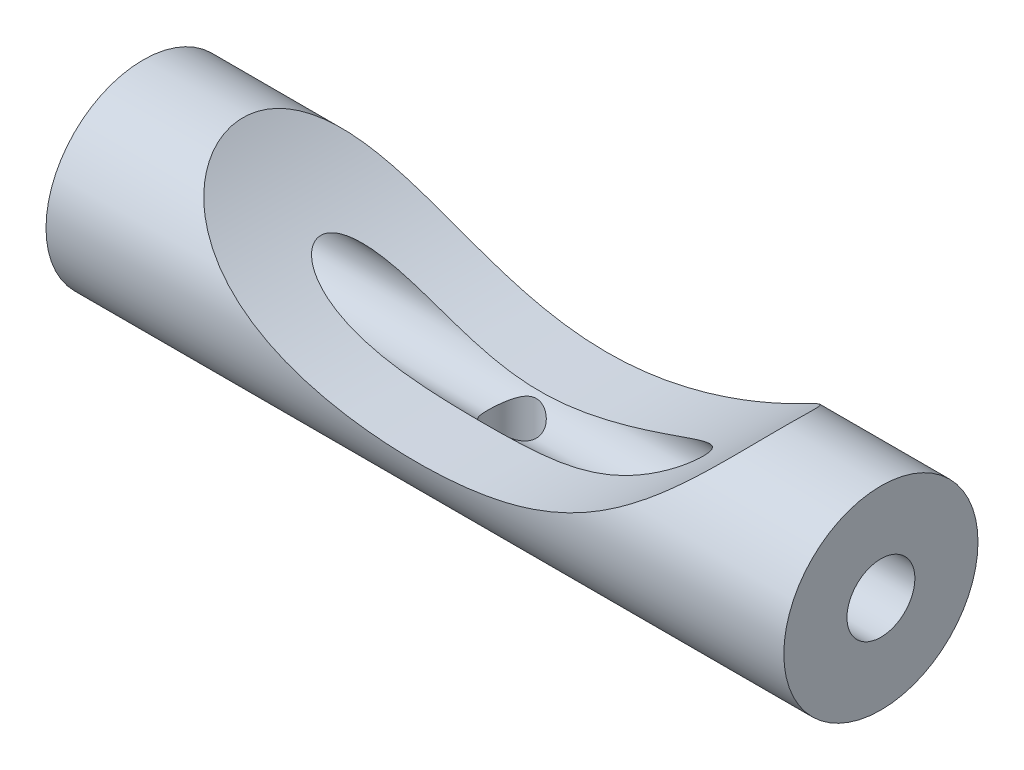
from build123d import *

# Parameters (mm, degrees)
SKETCH1_R               = 5
BOSS_EXTRUDE1_DEPTH     = 19
CUT_EXTRUDE1_DEPTH      = 21.273134933
CUT_EXTRUDE1_DEPTH_BACK = 21.273134933
SKETCH3_R               = 1.75
CUT_EXTRUDE2_DEPTH      = 20
SKETCH4_R               = 1.25
CUT_EXTRUDE3_DEPTH      = 21.273135076


with BuildPart() as part:
    # Sketch1 → Boss-Extrude1 (new, symmetric)
    with BuildSketch(Plane(origin=(0, 0, 0), x_dir=(0, 0, -1), z_dir=(1, 0, 0))):
        Circle(SKETCH1_R)
    extrude(amount=BOSS_EXTRUDE1_DEPTH, both=True)

    # Sketch2 → Cut-Extrude1 (cut, two sides: drawn at the far end of the back side and taken through both)
    with BuildSketch(Plane.XY.offset(-CUT_EXTRUDE1_DEPTH_BACK)):
        with BuildLine():
            Line((-67.696223967, 62.386645779), (-13.856406461, 5))
            ThreePointArc((-13.856406461, 5), (0, -1), (13.856406461, 5))
            Line((13.856406461, 5), (67.696223967, 62.386645779))
            Line((67.696223967, 62.386645779), (67.696223967, 219.764573876))
            Line((67.696223967, 219.764573876), (-67.696223967, 219.764573876))
            Line((-67.696223967, 219.764573876), (-67.696223967, 62.386645779))
        make_face()
    extrude(amount=CUT_EXTRUDE1_DEPTH + CUT_EXTRUDE1_DEPTH_BACK, mode=Mode.SUBTRACT)

    # Sketch3 → Cut-Extrude2 (cut, symmetric)
    with BuildSketch(Plane(origin=(0, 0, 0), x_dir=(0, 0, -1), z_dir=(1, 0, 0))):
        Circle(SKETCH3_R)
    extrude(amount=CUT_EXTRUDE2_DEPTH, both=True, mode=Mode.SUBTRACT)

    # Sketch4 → Cut-Extrude3 (cut, through all)
    with BuildSketch(Plane(origin=(0, 0, 0), x_dir=(1, 0, 0), z_dir=(0, 1, 0))):
        with Locations(Location((0, 0, 0), (0, 0, 270))):
            Circle(SKETCH4_R)
    extrude(amount=-CUT_EXTRUDE3_DEPTH, mode=Mode.SUBTRACT)


solid = part.part
